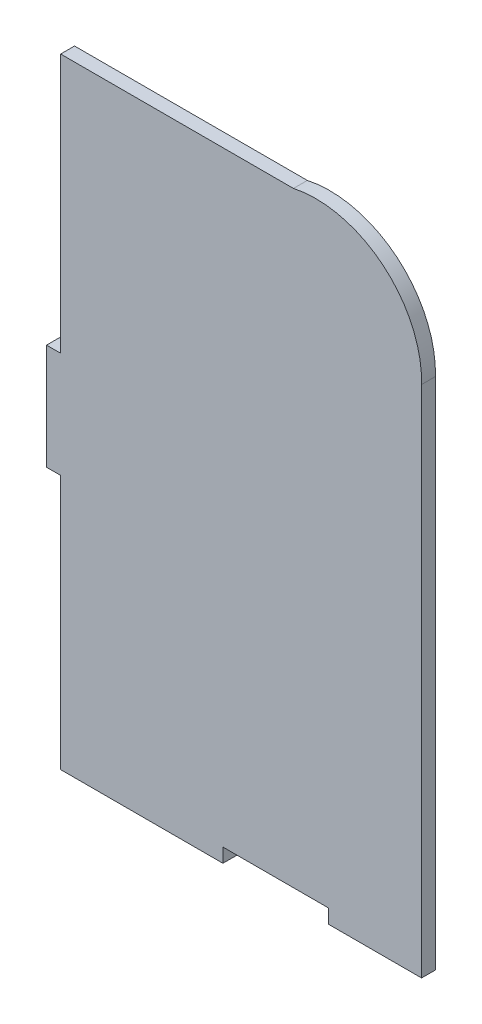
from build123d import *

# Parameters (mm, degrees)
BOSS_EXTRUDE1_DEPTH = 10


with BuildPart() as part:
    # Sketch1 → Boss-Extrude1 (new body)
    with BuildSketch(Plane.XY):
        with BuildLine():
            Line((215.836077164, -23.47), (383.528279606, -23.47))
            ThreePointArc((383.528279606, -23.47), (448.16096685, -39.182652673), (475.829586762, -99.67))
            Line((475.829586762, -99.67), (475.829586762, -469.9))
            Line((475.829586762, -469.9), (408.921789204, -469.9))
            Line((408.921789204, -469.9), (408.921789204, -459.74))
            Line((408.921789204, -459.74), (332.721789204, -459.74))
            Line((332.721789204, -459.74), (332.721789204, -469.9))
            Line((332.721789204, -469.9), (215.829586762, -469.9))
            Line((215.829586762, -469.9), (215.829586762, -286.36))
            Line((215.829586762, -286.36), (205.669586762, -286.36))
            Line((205.669586762, -286.36), (205.669586762, -210.16))
            Line((205.669586762, -210.16), (215.836077164, -210.16))
            Line((215.836077164, -210.16), (215.836077164, -23.47))
        make_face()
    extrude(amount=-BOSS_EXTRUDE1_DEPTH)


solid = part.part
